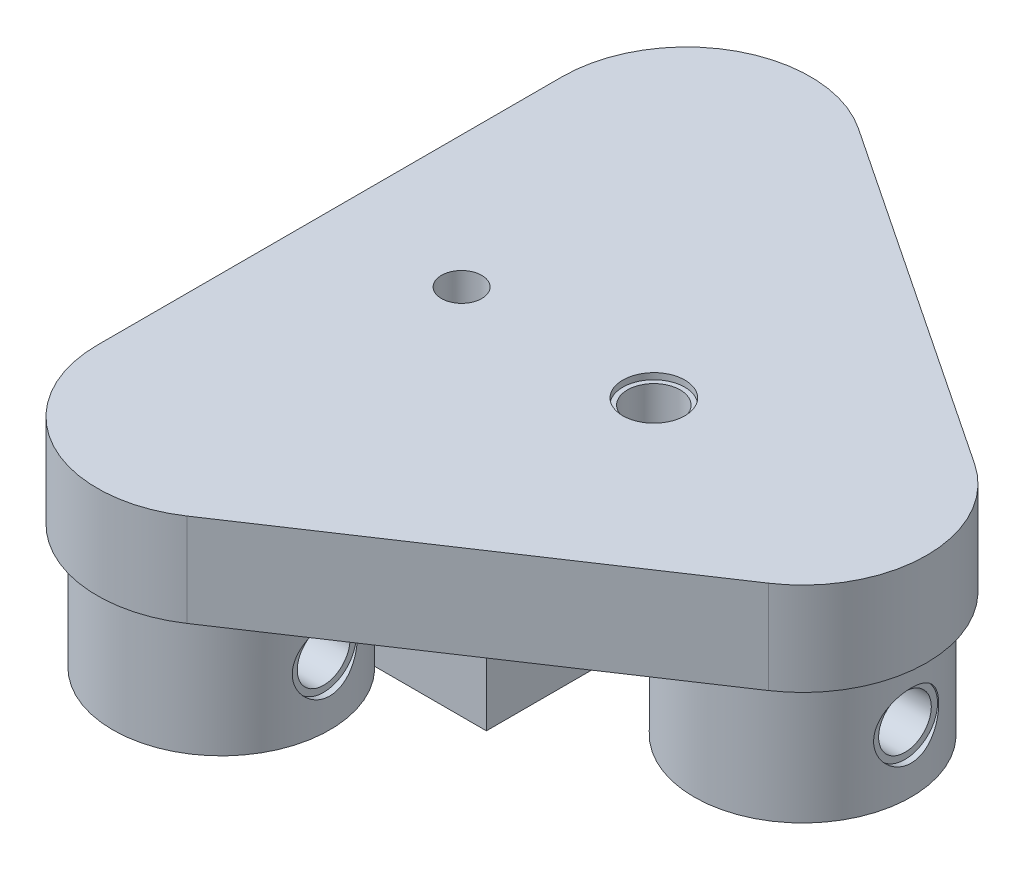
from build123d import *

# Parameters (mm, degrees)
BOSS_EXTRUDE1_DEPTH                              = 7.5
SKETCH6_W                                        = 19
SKETCH6_H                                        = 15
SKETCH6_W_2                                      = 15
SKETCH6_H_2                                      = 11
BOSS_EXTRUDE3_DEPTH                              = 15
M3_CLEARANCE_HOLE1_D                             = 3.25
CBORE_FOR_M5_HEX_HEAD_MACHINE_SCREW1_D           = 4.25
CBORE_FOR_M5_HEX_HEAD_MACHINE_SCREW1_CBORE_D     = 5
CBORE_FOR_M5_HEX_HEAD_MACHINE_SCREW1_CBORE_DEPTH = 0.5
SKETCH3_R                                        = 8.75
SKETCH3_R_2                                      = 5.125
BOSS_EXTRUDE4_DEPTH                              = 10
CBORE_FOR_M3_SHCS1_D                             = 4.25
CBORE_FOR_M3_SHCS1_DEPTH                         = 10
CBORE_FOR_M3_SHCS1_CBORE_D                       = 5.25
CBORE_FOR_M3_SHCS1_CBORE_DEPTH                   = 0.5
CBORE_FOR_M3_SHCS2_D                             = 4.25
CBORE_FOR_M3_SHCS2_DEPTH                         = 10
CBORE_FOR_M3_SHCS2_CBORE_D                       = 5.25
CBORE_FOR_M3_SHCS2_CBORE_DEPTH                   = 0.5
CUT_EXTRUDE1_START                               = -5
SKETCH15_R                                       = 5.125
CUT_EXTRUDE1_DEPTH                               = 5


with BuildPart() as part:
    # Sketch1 → Boss-Extrude1 (new body)
    with BuildSketch(Plane(origin=(0, 0, 0), x_dir=(1, 0, 0), z_dir=(0, 1, 0))):
        with BuildLine():
            Line((-38.125, 18.75), (-38.125, -18.75))
            ThreePointArc((-38.125, -18.75), (-32.843579255, -27.566745988), (-22.577998038, -27.070502943))
            Line((-22.577998038, -27.070502943), (5.547001962, -8.320502943))
            ThreePointArc((5.547001962, -8.320502943), (10, 0), (5.547001962, 8.320502943))
            Line((5.547001962, 8.320502943), (-22.577998038, 27.070502943))
            ThreePointArc((-22.577998038, 27.070502943), (-32.843579255, 27.566745988), (-38.125, 18.75))
        make_face()
    extrude(amount=BOSS_EXTRUDE1_DEPTH)

    # Sketch6 → Boss-Extrude3 (add)
    with BuildSketch(Plane.XZ):
        with Locations((-27.5, 0)):
            Rectangle(SKETCH6_W, SKETCH6_H)
        with Locations((-27.5, 0)):
            Rectangle(SKETCH6_W_2, SKETCH6_H_2, mode=Mode.SUBTRACT)
    extrude(amount=BOSS_EXTRUDE3_DEPTH)

    # M3 Clearance Hole1 (through all)
    with Locations(Plane.XZ):
        with Locations((-27.5, 0)):
            Hole(M3_CLEARANCE_HOLE1_D / 2)

    # CBORE for M5 Hex Head Machine Screw1 (through all)
    with Locations(Plane(origin=(0, 7.5, 0), x_dir=(1, 0, 0), z_dir=(0, 1, 0))):
        with Locations((-12, 0)):
            CounterBoreHole(CBORE_FOR_M5_HEX_HEAD_MACHINE_SCREW1_D / 2, CBORE_FOR_M5_HEX_HEAD_MACHINE_SCREW1_CBORE_D / 2, CBORE_FOR_M5_HEX_HEAD_MACHINE_SCREW1_CBORE_DEPTH)

    # Sketch3 → Boss-Extrude4 (add)
    # profile 1 of 3: a face of its own
    with BuildSketch(Plane.XZ):
        with Locations(Location((-28.125, 18.75, 0), (0, 0, 90))):
            Circle(SKETCH3_R)
        with Locations(Location((-28.125, 18.75, 0), (0, 0, 270))):
            Circle(SKETCH3_R_2, mode=Mode.SUBTRACT)
    # profile 2 of 3: a face of its own
    with BuildSketch(Plane.XZ):
        with Locations(Location((-28.125, -18.75, 0), (0, 0, 90))):
            Circle(SKETCH3_R)
        with Locations(Location((-28.125, -18.75, 0), (0, 0, 270))):
            Circle(SKETCH3_R_2, mode=Mode.SUBTRACT)
    # profile 3 of 3: a face of its own
    with BuildSketch(Plane.XZ):
        with Locations(Location((0, 0, 0), (0, 0, 90))):
            Circle(SKETCH3_R)
        with Locations(Location((0, 0, 0), (0, 0, 270))):
            Circle(SKETCH3_R_2, mode=Mode.SUBTRACT)
    extrude(amount=BOSS_EXTRUDE4_DEPTH)

    # CBORE for M3 SHCS1
    with Locations(Plane(origin=(-19.375, 0, 0), x_dir=(0, 0, -1), z_dir=(1, 0, 0))):
        with Locations((-18.75, -5), (18.75, -5)):
            CounterBoreHole(CBORE_FOR_M3_SHCS1_D / 2, CBORE_FOR_M3_SHCS1_CBORE_D / 2, CBORE_FOR_M3_SHCS1_CBORE_DEPTH, depth=CBORE_FOR_M3_SHCS1_DEPTH)

    # CBORE for M3 SHCS2
    with Locations(Plane(origin=(8.75, 0, 0), x_dir=(0, 0, -1), z_dir=(1, 0, 0))):
        with Locations((0, -5)):
            CounterBoreHole(CBORE_FOR_M3_SHCS2_D / 2, CBORE_FOR_M3_SHCS2_CBORE_D / 2, CBORE_FOR_M3_SHCS2_CBORE_DEPTH, depth=CBORE_FOR_M3_SHCS2_DEPTH)

    # Sketch15 → Cut-Extrude1 (cut)
    with BuildSketch(Plane.XZ.offset(CUT_EXTRUDE1_START)):
        with Locations(Location((-28.125, 18.75, 0), (0, 0, 270))):
            Circle(SKETCH15_R)
        with Locations(Location((0, 0, 0), (0, 0, 270))):
            Circle(SKETCH15_R)
        with Locations(Location((-28.125, -18.75, 0), (0, 0, 270))):
            Circle(SKETCH15_R)
    extrude(amount=CUT_EXTRUDE1_DEPTH, mode=Mode.SUBTRACT)


solid = part.part
